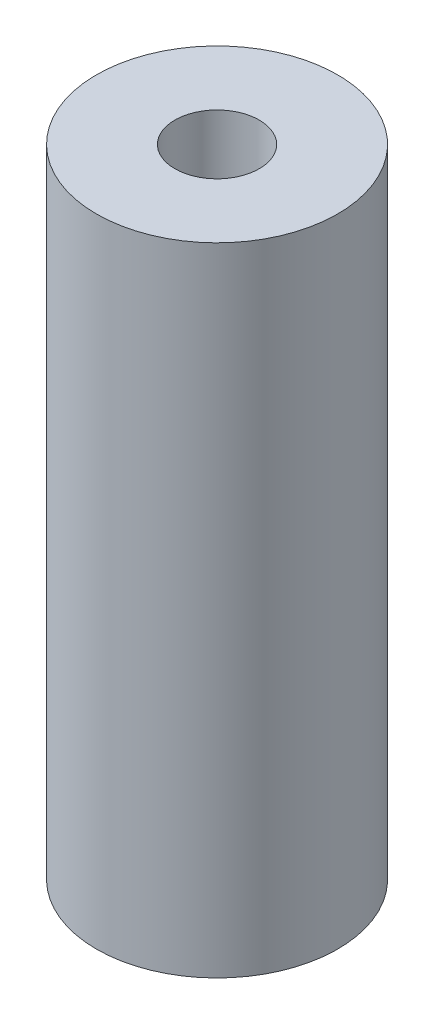
from build123d import *

# Parameters (mm, degrees)
SKETCH1_R           = 5
SKETCH1_R_2         = 1.75
BOSS_EXTRUDE1_DEPTH = 26.4


with BuildPart() as part:
    # Sketch1 → Boss-Extrude1 (new body)
    with BuildSketch(Plane(origin=(0, 0, 0), x_dir=(1, 0, 0), z_dir=(0, 1, 0))):
        with Locations(Location((0, 0, 0), (0, 0, 270))):
            Circle(SKETCH1_R)
        with Locations(Location((0, 0, 0), (0, 0, 270))):
            Circle(SKETCH1_R_2, mode=Mode.SUBTRACT)
    extrude(amount=BOSS_EXTRUDE1_DEPTH)


solid = part.part
